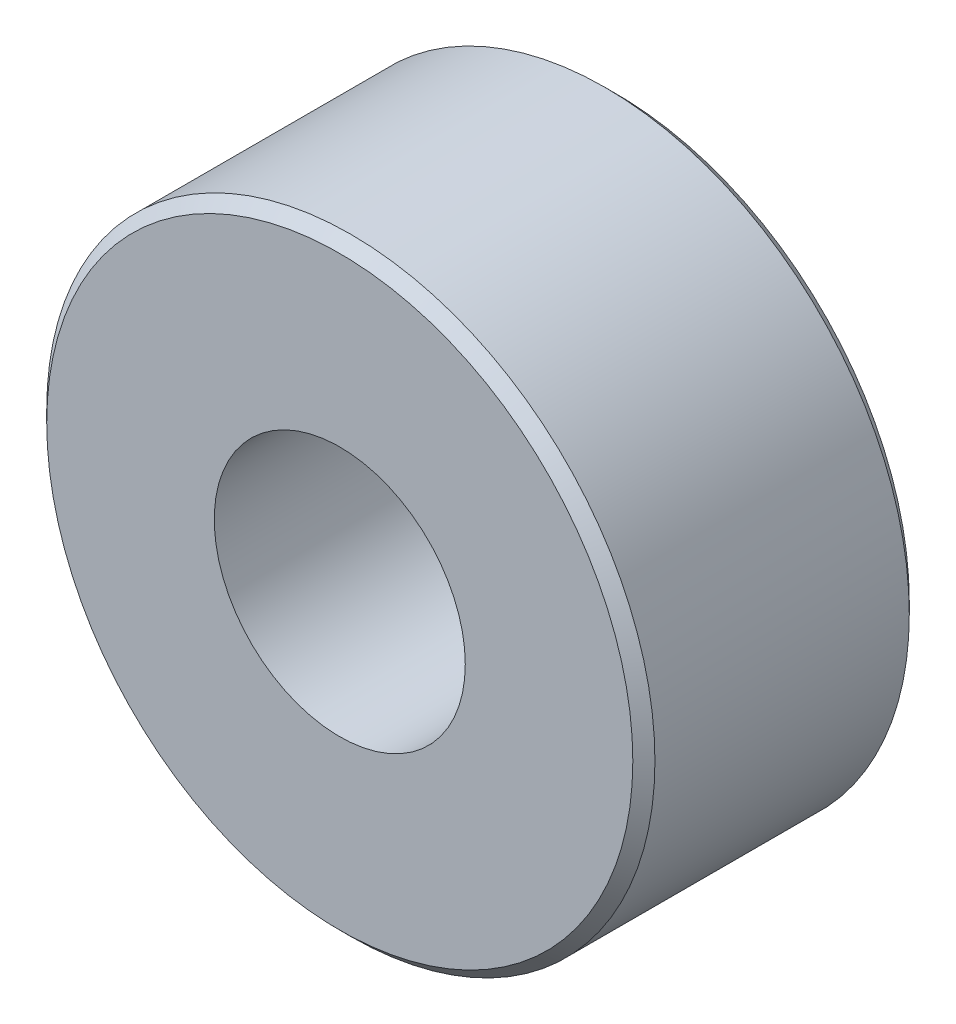
from build123d import *

# Parameters (mm, degrees)
SKETCH1_R               = 27.5
BOSS_EXTRUDE1_DEPTH     = 12.5
CUT_EXTRUDE1_DEPTH      = 41.850336596
CUT_EXTRUDE1_DEPTH_BACK = 41.850336596
SKETCH2_R               = 11.35
CHAMFER1_SIZE           = 1


with BuildPart() as part:
    # Sketch1 → Boss-Extrude1 (new, symmetric)
    with BuildSketch(Plane.XY):
        Circle(SKETCH1_R)
    extrude(amount=BOSS_EXTRUDE1_DEPTH, both=True)

    # Sketch2 → Cut-Extrude1 (cut, two sides: drawn at the far end of the back side and taken through both)
    with BuildSketch(Plane.XY.offset(-CUT_EXTRUDE1_DEPTH_BACK)):
        Circle(SKETCH2_R)
    extrude(amount=CUT_EXTRUDE1_DEPTH + CUT_EXTRUDE1_DEPTH_BACK, mode=Mode.SUBTRACT)

    # Chamfer1
    chamfer1_edges = [part.edges().sort_by_distance(p)[0] for p in [
        (-27.5, 0, -12.5),
        (-27.5, 0, 12.5),
    ]]
    chamfer(chamfer1_edges, length=CHAMFER1_SIZE)


solid = part.part
